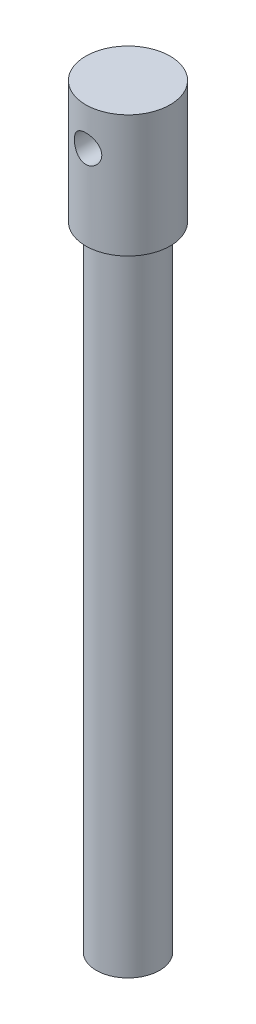
from build123d import *

# Parameters (mm, degrees)
SKETCH_1_R               = 7.5
EXTRUDE_1_DEPTH          = 150
SKETCH_2_R               = 10
EXTRUDE_2_DEPTH          = 29
CUT_EXTRUDE_1_DEPTH      = 180.55779014
CUT_EXTRUDE_1_DEPTH_BACK = 180.55779014
SKETCH_3_R               = 3.25


with BuildPart() as part:
    # 草图1 → 凸台-拉伸1 (new body)
    with BuildSketch(Plane(origin=(0, 0, 0), x_dir=(1, 0, 0), z_dir=(0, 1, 0))):
        with Locations(Location((0, 0, 0), (0, 0, 270))):
            Circle(SKETCH_1_R)
    extrude(amount=EXTRUDE_1_DEPTH)

    # 草图2 → 凸台-拉伸2 (add)
    with BuildSketch(Plane(origin=(0, 150, 0), x_dir=(1, 0, 0), z_dir=(0, 1, 0))):
        with Locations(Location((0, 0, 0), (0, 0, 90))):
            Circle(SKETCH_2_R)
    extrude(amount=EXTRUDE_2_DEPTH)

    # 草图3 → 切除-拉伸1 (cut, two sides: drawn at the far end of the back side and taken through both)
    with BuildSketch(Plane.XY.offset(-CUT_EXTRUDE_1_DEPTH_BACK)):
        with Locations(Location((0, 170, 0), (0, 0, 89.999999989))):
            Circle(SKETCH_3_R)
    extrude(amount=CUT_EXTRUDE_1_DEPTH + CUT_EXTRUDE_1_DEPTH_BACK, mode=Mode.SUBTRACT)


solid = part.part
